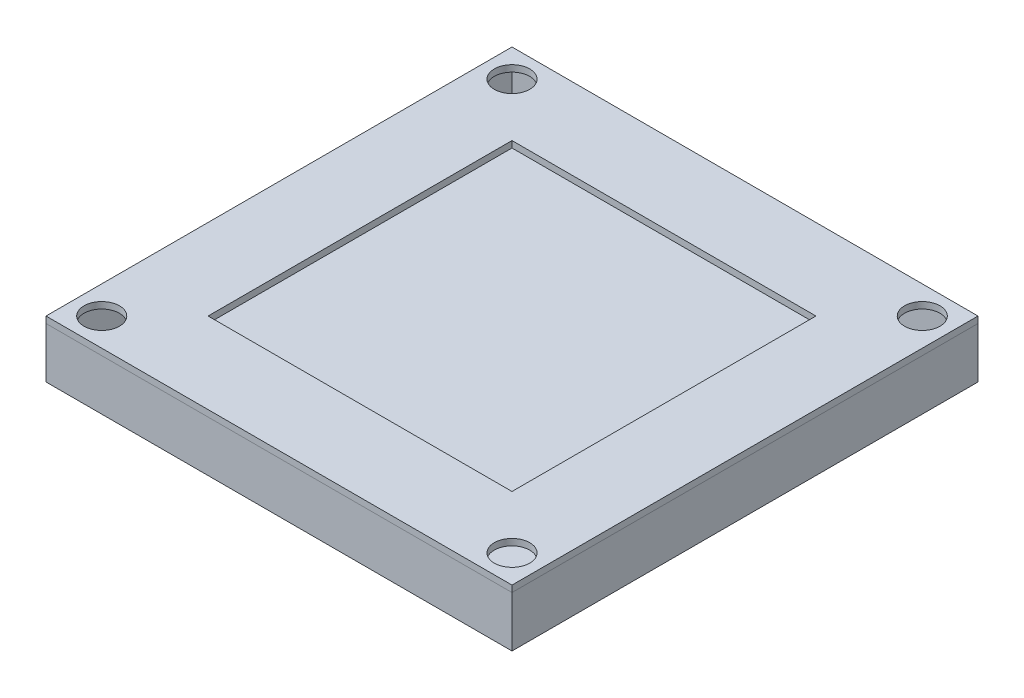
from build123d import *

# Parameters (mm, degrees)
SKETCH1_W           = 292.1
SKETCH1_H           = 292.1
SKETCH1_W_2         = 283.972
SKETCH1_H_2         = 283.972
BOSS_EXTRUDE1_DEPTH = 31.75
SKETCH2_W           = 292.1
SKETCH2_H           = 292.1
BOSS_EXTRUDE2_DEPTH = 1.524
SKETCH3_W           = 292.1
SKETCH3_H           = 292.1
SKETCH3_R           = 11.1125
SKETCH3_W_2         = 190.5
SKETCH3_H_2         = 190.5
BOSS_EXTRUDE3_DEPTH = 4.064


with BuildPart() as part:
    # Sketch1 → Boss-Extrude1 (new body)
    with BuildSketch(Plane(origin=(0, 0, 0), x_dir=(1, 0, 0), z_dir=(0, 1, 0))):
        Rectangle(SKETCH1_W, SKETCH1_H)
        Rectangle(SKETCH1_W_2, SKETCH1_H_2, mode=Mode.SUBTRACT)
    extrude(amount=BOSS_EXTRUDE1_DEPTH)

    # Sketch2 → Boss-Extrude2 (add)
    with BuildSketch(Plane.XZ):
        Rectangle(SKETCH2_W, SKETCH2_H)
    extrude(amount=-BOSS_EXTRUDE2_DEPTH)


with BuildPart() as body_2:
    # Sketch3 → Boss-Extrude3 (new body)
    with BuildSketch(Plane(origin=(0, 31.75, 0), x_dir=(1, 0, 0), z_dir=(0, 1, 0))):
        Rectangle(SKETCH3_W, SKETCH3_H)
        with Locations(Location((-128.5875, 128.5875, 0), (0, 0, 270))):
            Circle(SKETCH3_R, mode=Mode.SUBTRACT)
        with Locations(Location((-128.5875, -128.5875, 0), (0, 0, 270))):
            Circle(SKETCH3_R, mode=Mode.SUBTRACT)
        with Locations(Location((128.5875, -128.5875, 0), (0, 0, 270))):
            Circle(SKETCH3_R, mode=Mode.SUBTRACT)
        with Locations(Location((128.5875, 128.5875, 0), (0, 0, 270))):
            Circle(SKETCH3_R, mode=Mode.SUBTRACT)
        Rectangle(SKETCH3_W_2, SKETCH3_H_2, mode=Mode.SUBTRACT)
    extrude(amount=BOSS_EXTRUDE3_DEPTH)


solid = Compound([part.part, body_2.part])
